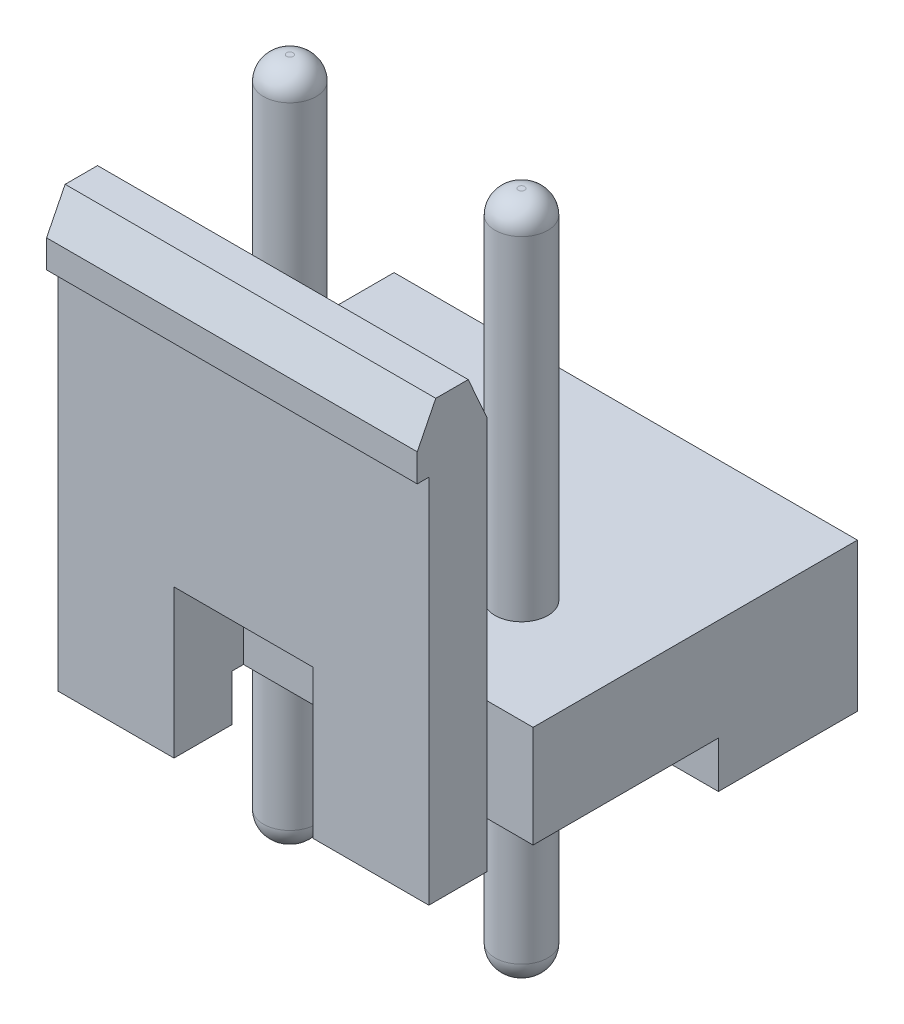
from build123d import *

# Parameters (mm, degrees)
CROQUIS1_W              = 10
CROQUIS1_H              = 8.5
SALIENTE_EXTRUIR1_DEPTH = 9.4
CROQUIS2_W              = 10
CROQUIS2_H              = 7
CORTAR_EXTRUIR1_DEPTH   = 6.2
CROQUIS3_W              = 0.25
CROQUIS3_H              = 8
CORTAR_EXTRUIR2_DEPTH   = 10
CROQUIS4_W              = 3
CROQUIS4_H              = 0.5
CORTAR_EXTRUIR3_DEPTH   = 10
CROQUIS5_W              = 4
CROQUIS5_H              = 1
CORTAR_EXTRUIR4_DEPTH   = 10
CROQUIS6_R              = 0.57
SALIENTE_EXTRUIR2_DEPTH = 7.3
REDONDEO2_R             = 0.5
CROQUIS7_W              = 1
CROQUIS7_H              = 1.5
CORTAR_EXTRUIR5_DEPTH   = 14.8
CROQUIS8_W              = 3
CROQUIS8_H              = 3.2
CORTAR_EXTRUIR6_DEPTH   = 1.5
CORTAR_EXTRUIR7_DEPTH   = 10


with BuildPart() as part:
    # Croquis1 → Saliente-Extruir1 (new body)
    with BuildSketch(Plane(origin=(0, 0, 0), x_dir=(1, 0, 0), z_dir=(0, 1, 0))):
        Rectangle(CROQUIS1_W, CROQUIS1_H)
    extrude(amount=SALIENTE_EXTRUIR1_DEPTH)

    # Croquis2 → Cortar-Extruir1 (cut)
    with BuildSketch(Plane(origin=(0, 9.4, 0), x_dir=(1, 0, 0), z_dir=(0, 1, 0))):
        with Locations((0, 0.75)):
            Rectangle(CROQUIS2_W, CROQUIS2_H)
    extrude(amount=-CORTAR_EXTRUIR1_DEPTH, mode=Mode.SUBTRACT)

    # Croquis3 → Cortar-Extruir2 (cut)
    with BuildSketch(Plane.ZY.offset(5)):
        with Locations((4.125, 4)):
            Rectangle(CROQUIS3_W, CROQUIS3_H)
    extrude(amount=-CORTAR_EXTRUIR2_DEPTH, mode=Mode.SUBTRACT)

    # Croquis4 → Cortar-Extruir3 (cut)
    with BuildSketch(Plane(origin=(0, 0, -4.25), x_dir=(-1, 0, 0), z_dir=(0, 0, -1))):
        with Locations((0, 0.25)):
            Rectangle(CROQUIS4_W, CROQUIS4_H)
    extrude(amount=-CORTAR_EXTRUIR3_DEPTH, mode=Mode.SUBTRACT)

    # Croquis5 → Cortar-Extruir4 (cut)
    with BuildSketch(Plane.ZY.offset(5)):
        with Locations((0.75, 0.5)):
            Rectangle(CROQUIS5_W, CROQUIS5_H)
    extrude(amount=-CORTAR_EXTRUIR4_DEPTH, mode=Mode.SUBTRACT)

    # Croquis6 → Saliente-Extruir2 (add, symmetric)
    with BuildSketch(Plane(origin=(0, 3.6, 0), x_dir=(1, 0, 0), z_dir=(0, 1, 0))):
        with Locations(Location((-2.5, -0.5, 0), (0, 0, 270))):
            Circle(CROQUIS6_R)
        with Locations(Location((2.5, -0.5, 0), (0, 0, 270))):
            Circle(CROQUIS6_R)
    extrude(amount=SALIENTE_EXTRUIR2_DEPTH, both=True)

    # Redondeo2
    redondeo2_edges = [part.edges().sort_by_distance(p)[0] for p in [
        (2.5, -3.7, -0.07),
        (2.5, 10.9, -0.07),
        (-2.5, -3.7, -0.07),
        (-2.5, 10.9, -0.07),
    ]]
    fillet(redondeo2_edges, radius=REDONDEO2_R)

    # Croquis7 → Cortar-Extruir5 (cut)
    with BuildSketch(Plane(origin=(0, 9.4, 0), x_dir=(1, 0, 0), z_dir=(0, 1, 0))):
        with Locations((-4.5, -3.5)):
            Rectangle(CROQUIS7_W, CROQUIS7_H)
        with Locations((4.5, -3.5)):
            Rectangle(CROQUIS7_W, CROQUIS7_H)
    extrude(amount=-CORTAR_EXTRUIR5_DEPTH, mode=Mode.SUBTRACT)

    # Croquis8 → Cortar-Extruir6 (cut)
    with BuildSketch(Plane.XY.offset(4)):
        with Locations((0, 1.6)):
            Rectangle(CROQUIS8_W, CROQUIS8_H)
    extrude(amount=-CORTAR_EXTRUIR6_DEPTH, mode=Mode.SUBTRACT)

    # Croquis9 → Cortar-Extruir7 (cut)
    with BuildSketch(Plane.ZY.offset(4)):
        Polygon((4.25, 8.6), (4.25, 9.4), (3.85, 9.4), align=None)
        Polygon((2.75, 8.5), (2.75, 9.4), (3.15, 9.4), align=None)
    extrude(amount=-CORTAR_EXTRUIR7_DEPTH, mode=Mode.SUBTRACT)


solid = part.part
